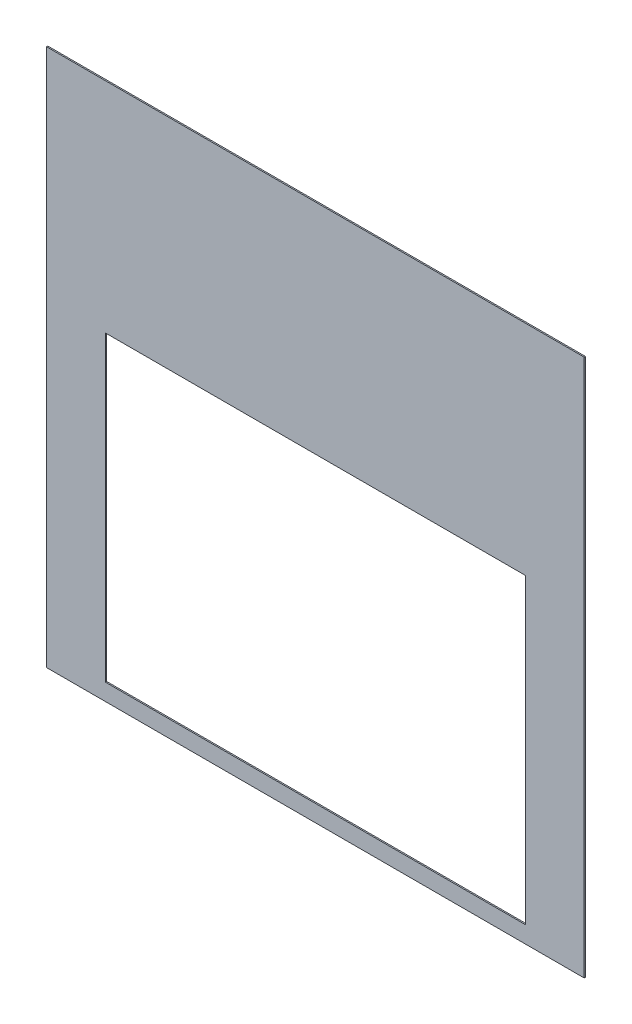
from build123d import *

# Parameters (mm, degrees)
PRESS_PANEL_PRES_AGZI_1_START = 38.5
SKETCH1_W                     = 640
SKETCH1_H                     = 640
PRESS_PANEL_PRES_AGZI_1_DEPTH = 1.5
PRESS_PANEL_PRES_AGZI_2_START = 37.5
SKETCH2_W                     = 500
SKETCH2_H                     = 360
PRESS_PANEL_PRES_AGZI_2_DEPTH = 3.5


with BuildPart() as part:
    # Sketch1 → PRESS_panel_pres_agzi_1 (new body)
    with BuildSketch(Plane.XY.offset(PRESS_PANEL_PRES_AGZI_1_START)):
        with Locations((350, 1020)):
            Rectangle(SKETCH1_W, SKETCH1_H)
    extrude(amount=PRESS_PANEL_PRES_AGZI_1_DEPTH)

    # Sketch2 → PRESS_panel_pres_agzi_2 (cut)
    with BuildSketch(Plane.XY.offset(PRESS_PANEL_PRES_AGZI_2_START)):
        with Locations((350, 900)):
            Rectangle(SKETCH2_W, SKETCH2_H)
    extrude(amount=PRESS_PANEL_PRES_AGZI_2_DEPTH, mode=Mode.SUBTRACT)


solid = part.part
